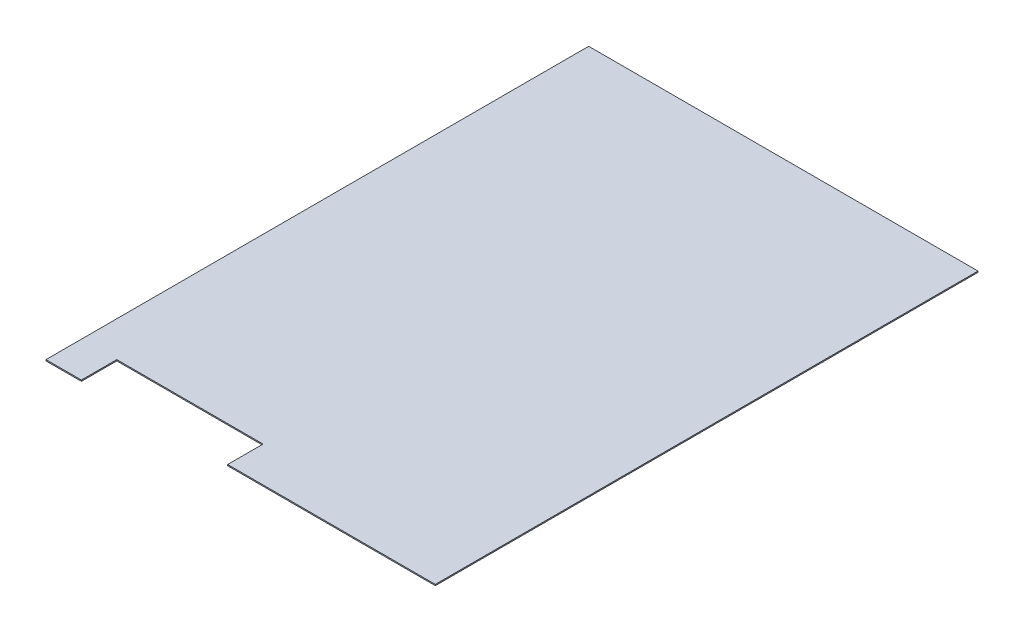
from build123d import *

# Parameters (mm, degrees)
SKETCH1_W           = 165
SKETCH1_H           = 230
BOSS_EXTRUDE1_DEPTH = 0.5
SKETCH2_W           = 62
SKETCH2_H           = 15
CUT_EXTRUDE1_DEPTH  = 10


with BuildPart() as part:
    # Sketch1 → Boss-Extrude1 (new body)
    with BuildSketch(Plane(origin=(0, 0, 0), x_dir=(1, 0, 0), z_dir=(0, 1, 0))):
        Rectangle(SKETCH1_W, SKETCH1_H)
    extrude(amount=BOSS_EXTRUDE1_DEPTH)

    # Sketch2 → Cut-Extrude1 (cut)
    with BuildSketch(Plane(origin=(0, 0.5, 0), x_dir=(1, 0, 0), z_dir=(0, 1, 0))):
        with Locations((-36.5, -107.5)):
            Rectangle(SKETCH2_W, SKETCH2_H)
    extrude(amount=-CUT_EXTRUDE1_DEPTH, mode=Mode.SUBTRACT)


solid = part.part
